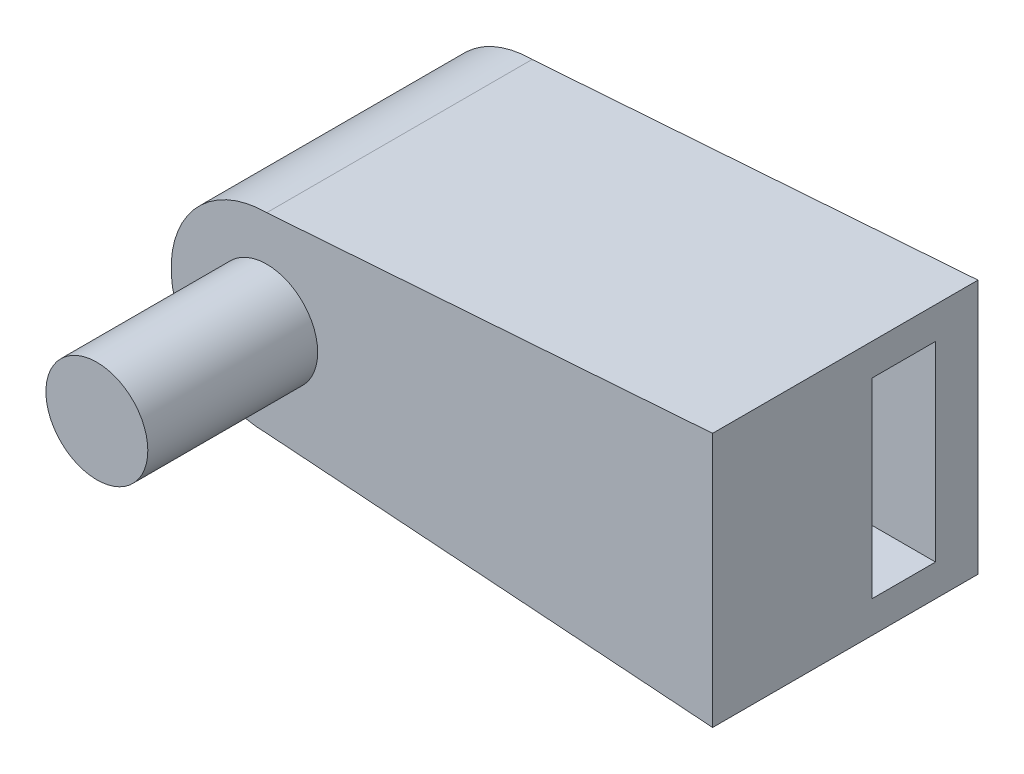
from build123d import *

# Parameters (mm, degrees)
BOSS_EXTRUDE2_DEPTH = 3
BOSS_EXTRUDE3_DEPTH = 7.5
BOSS_EXTRUDE4_START = 2
BOSS_EXTRUDE4_DEPTH = 2
SKETCH5_R           = 2.4
BOSS_EXTRUDE5_DEPTH = 8


with BuildPart() as part:
    # Sketch1 → Boss-Extrude2 (new body)
    with BuildSketch(Plane(origin=(0, 0, 0), x_dir=(0, 1, 0), z_dir=(0, 0, 1))):
        with BuildLine():
            Line((0, 0), (1.5, 0))
            Line((1.5, 0), (1.5, 5))
            Line((1.5, 5), (3, 15))
            ThreePointArc((3, 15), (6, 18), (9, 15))
            Line((9, 15), (10.5, 5))
            Line((10.5, 5), (10.5, 0))
            Line((10.5, 0), (12, 0))
            Line((12, 0), (10.5, 21))
            ThreePointArc((10.5, 21), (6, 25.5), (1.5, 21))
            Line((1.5, 21), (0, 0))
        make_face()
    extrude(amount=BOSS_EXTRUDE2_DEPTH)

    # Sketch3 → Boss-Extrude3 (add)
    with BuildSketch(Plane.XY.offset(3)):
        with BuildLine():
            Line((0, 0), (0, 12))
            Line((0, 12), (-21, 10.5))
            ThreePointArc((-21, 10.5), (-25.5, 6), (-21, 1.5))
            Line((-21, 1.5), (0, 0))
        make_face()
    extrude(amount=BOSS_EXTRUDE3_DEPTH)

    # Sketch4 → Boss-Extrude4 (add)
    with BuildSketch(Plane(origin=(0, 0, 0), x_dir=(1, 0, 0), z_dir=(0, 0, -1)).offset(BOSS_EXTRUDE4_START)):
        with BuildLine():
            Line((0, 0), (0, -12))
            Line((0, -12), (-21, -10.5))
            ThreePointArc((-21, -10.5), (-25.5, -6), (-21, -1.5))
            Line((-21, -1.5), (0, 0))
        make_face()
    extrude(amount=-BOSS_EXTRUDE4_DEPTH)

    # Sketch5 → Boss-Extrude5 (add)
    with BuildSketch(Plane.XY.offset(10.5)):
        with Locations((-21, 6)):
            Circle(SKETCH5_R)
    extrude(amount=BOSS_EXTRUDE5_DEPTH)


solid = part.part
